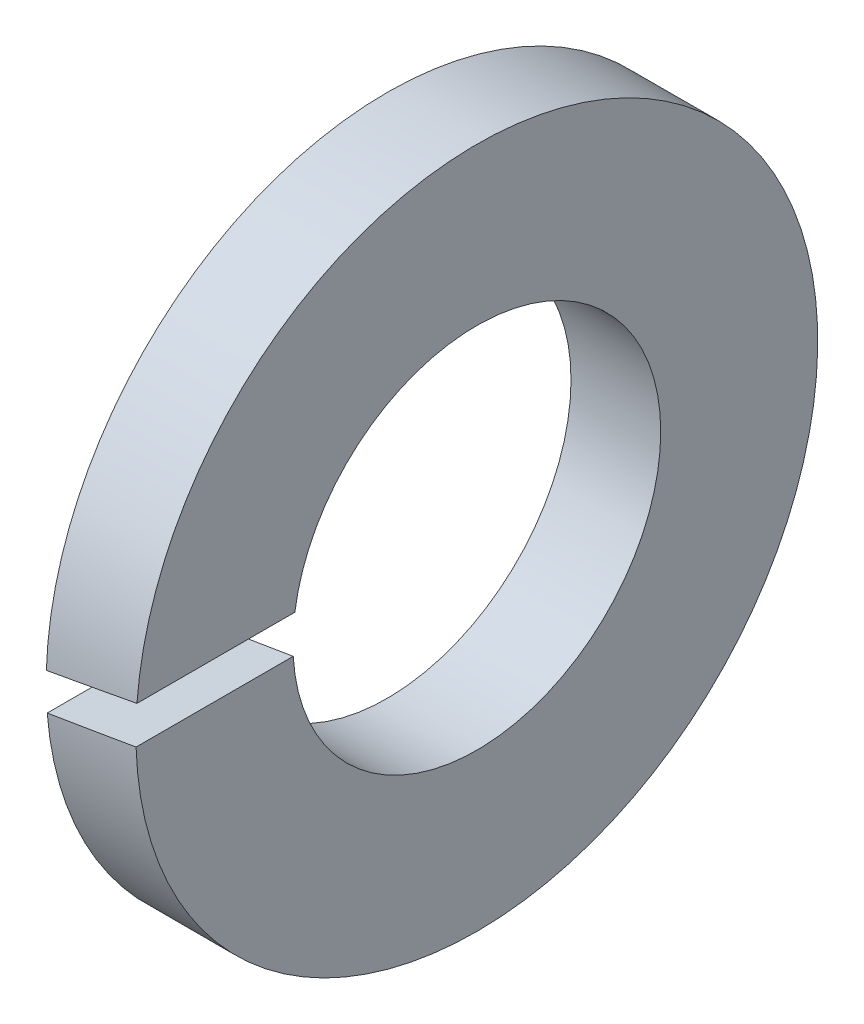
from build123d import *

# Parameters (mm, degrees)
SKETCH1_W          = 1
SKETCH1_H          = 1.75
CUT_EXTRUDE1_DEPTH = 6.466260147


with BuildPart() as part:
    # Sketch1 → Revolve1 (revolve)
    with BuildSketch(Plane.XY, mode=Mode.PRIVATE) as revolve1_sk:
        with Locations((-0.5, 2.925)):
            Rectangle(SKETCH1_W, SKETCH1_H)
    revolve(revolve1_sk.sketch.rotate(Axis((-1, 0, 0), (1, 0, 0)), 90), axis=Axis((-1, 0, 0), (1, 0, 0)))

    # Sketch2 → Cut-Extrude1 (cut, through all)
    with BuildSketch(Plane.XY):
        Polygon((-1, 0.119998965), (0, 0.296325946), (0, -0.119998965), (-1, -0.296325946), align=None)
    extrude(amount=CUT_EXTRUDE1_DEPTH, mode=Mode.SUBTRACT)


solid = part.part
